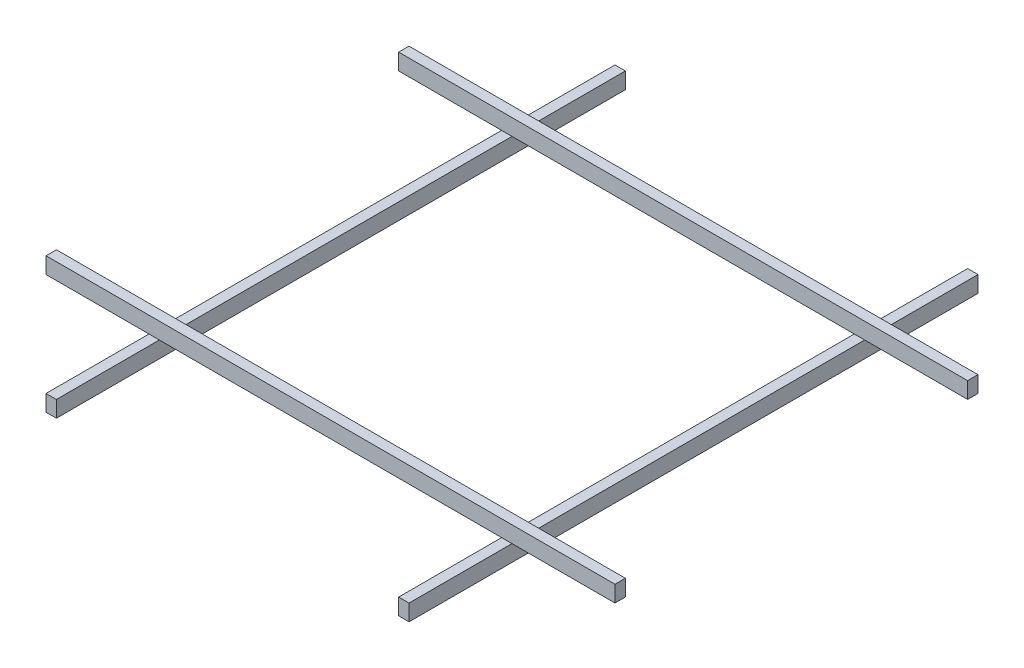
from build123d import *

# Parameters (mm, degrees)
SKETCH1_W              = 88.9
SKETCH1_H              = 139.7
PROFILES_4X6_1_DEPTH   = 4876.8
SKETCH1_ON_SEGMENT_2_W = 88.9
SKETCH1_ON_SEGMENT_2_H = 139.7
PROFILES_4X6_1_2_DEPTH = 4876.8
SKETCH1_ON_SEGMENT_3_W = 88.9
SKETCH1_ON_SEGMENT_3_H = 139.7
PROFILES_4X6_1_3_DEPTH = 4876.8
SKETCH1_ON_SEGMENT_4_W = 88.9
SKETCH1_ON_SEGMENT_4_H = 139.7
PROFILES_4X6_1_4_DEPTH = 4876.8


with BuildPart() as part:
    # Sketch1 → Profiles 4X6(1) (new body)
    with BuildSketch(Plane(origin=(622.3, 0, 0), x_dir=(-1, 0, 0), z_dir=(0, 0, -1))):
        Rectangle(SKETCH1_W, SKETCH1_H)
    extrude(amount=PROFILES_4X6_1_DEPTH)


with BuildPart() as body_2:
    # Sketch1 on segment 2 (carried to segment 2) → Profiles 4X6_1 2 (new body)
    with BuildSketch(Plane(origin=(3644.9, 0, 0), x_dir=(-1, 0, 0), z_dir=(0, 0, -1))):
        Rectangle(SKETCH1_ON_SEGMENT_2_W, SKETCH1_ON_SEGMENT_2_H)
    extrude(amount=PROFILES_4X6_1_2_DEPTH)


with BuildPart() as body_3:
    # Sketch1 on segment 3 (carried to segment 3) → Profiles 4X6_1 3 (new body)
    with BuildSketch(Plane(origin=(-304.8, 139.7, -3949.7), x_dir=(0, 0, -1), z_dir=(1, 0, 0))):
        Rectangle(SKETCH1_ON_SEGMENT_3_W, SKETCH1_ON_SEGMENT_3_H)
    extrude(amount=PROFILES_4X6_1_3_DEPTH)


with BuildPart() as body_4:
    # Sketch1 on segment 4 (carried to segment 4) → Profiles 4X6_1 4 (new body)
    with BuildSketch(Plane(origin=(4572, 139.7, -927.1), x_dir=(0, 0, 1), z_dir=(-1, 0, 0))):
        Rectangle(SKETCH1_ON_SEGMENT_4_W, SKETCH1_ON_SEGMENT_4_H)
    extrude(amount=PROFILES_4X6_1_4_DEPTH)


solid = Compound([part.part, body_2.part, body_3.part, body_4.part])
